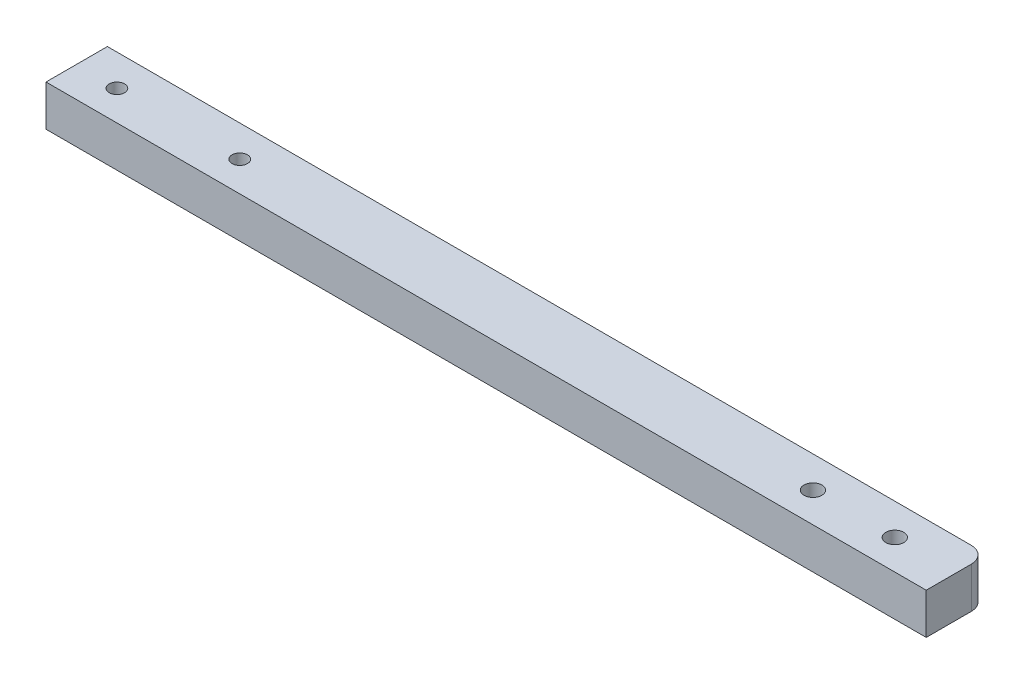
from build123d import *

# Parameters (mm, degrees)
SKETCH1_W           = 304.8
SKETCH1_H           = 304.8
BOSS_EXTRUDE1_DEPTH = 6.35
CUT_EXTRUDE2_DEPTH  = 6.35
SKETCH3_R           = 1.190625
SKETCH3_R_2         = 1.3890625
CUT_EXTRUDE3_DEPTH  = 335.039575687
FILLET2_R           = 2.54


with BuildPart() as part:
    # Sketch1 → Boss-Extrude1 (new body)
    with BuildSketch(Plane(origin=(0, 0, 0), x_dir=(1, 0, 0), z_dir=(0, 1, 0))):
        with Locations((152.4, 152.4)):
            Rectangle(SKETCH1_W, SKETCH1_H)
    extrude(amount=BOSS_EXTRUDE1_DEPTH)

    # Sketch2 → Cut-Extrude2 (cut)
    with BuildSketch(Plane(origin=(0, 6.35, 0), x_dir=(1, 0, 0), z_dir=(0, 1, 0))):
        Polygon((136.525, 304.8), (136.525, 295.275), (0, 295.275), (0, 0), (304.8, 0), (304.8, 304.8), align=None)
    extrude(amount=-CUT_EXTRUDE2_DEPTH, mode=Mode.SUBTRACT)

    # Sketch3 → Cut-Extrude3 (cut, through all)
    with BuildSketch(Plane(origin=(0, 6.35, 0), x_dir=(1, 0, 0), z_dir=(0, 1, 0))):
        with Locations(Location((6.35, 299.92676377, 0), (0, 0, 270))):
            Circle(SKETCH3_R)
        with Locations(Location((25.4, 299.92676377, 0), (0, 0, 270))):
            Circle(SKETCH3_R)
        with Locations(Location((114.3, 299.92676377, 0), (0, 0, 270))):
            Circle(SKETCH3_R_2)
        with Locations(Location((127, 299.92676377, 0), (0, 0, 270))):
            Circle(SKETCH3_R_2)
    extrude(amount=-CUT_EXTRUDE3_DEPTH, mode=Mode.SUBTRACT)

    # Fillet2
    fillet2_edges = [part.edges().sort_by_distance(p)[0] for p in [
        (136.525, 3.175, -304.8),
    ]]
    fillet(fillet2_edges, radius=FILLET2_R)


solid = part.part
